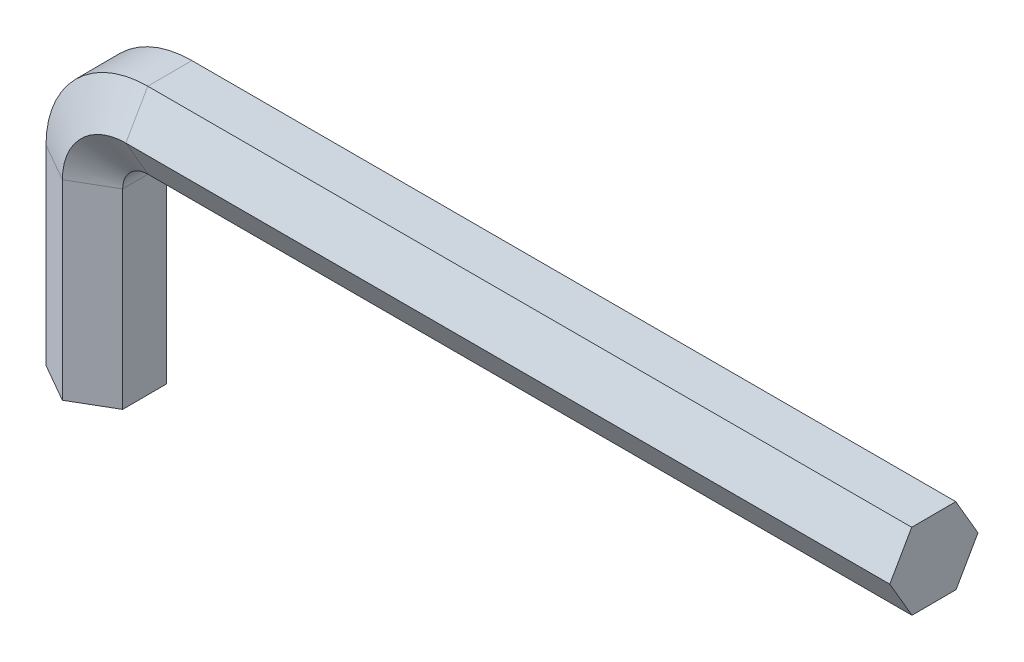
from build123d import *


with BuildPart() as part:
    # Sweep1: sweep along a path in Sketch1
    with BuildLine(Plane.XY) as sweep1_path:
        Line((0, 0), (-60, 0))
        ThreePointArc((-60, 0), (-63.535533906, -1.464466094), (-65, -5))
        Line((-65, -5), (-65, -20))
    # Sketch2 → Sweep1 (sweep)
    with BuildSketch(Plane.ZY):
        Polygon((1.720776661, -3.006480947), (3.464077206, -0.013004171), (1.743300546, 2.993476776), (-1.720776661, 3.006480947), (-3.464077206, 0.013004171), (-1.743300546, -2.993476776), align=None)
    sweep(path=sweep1_path.line)


solid = part.part
